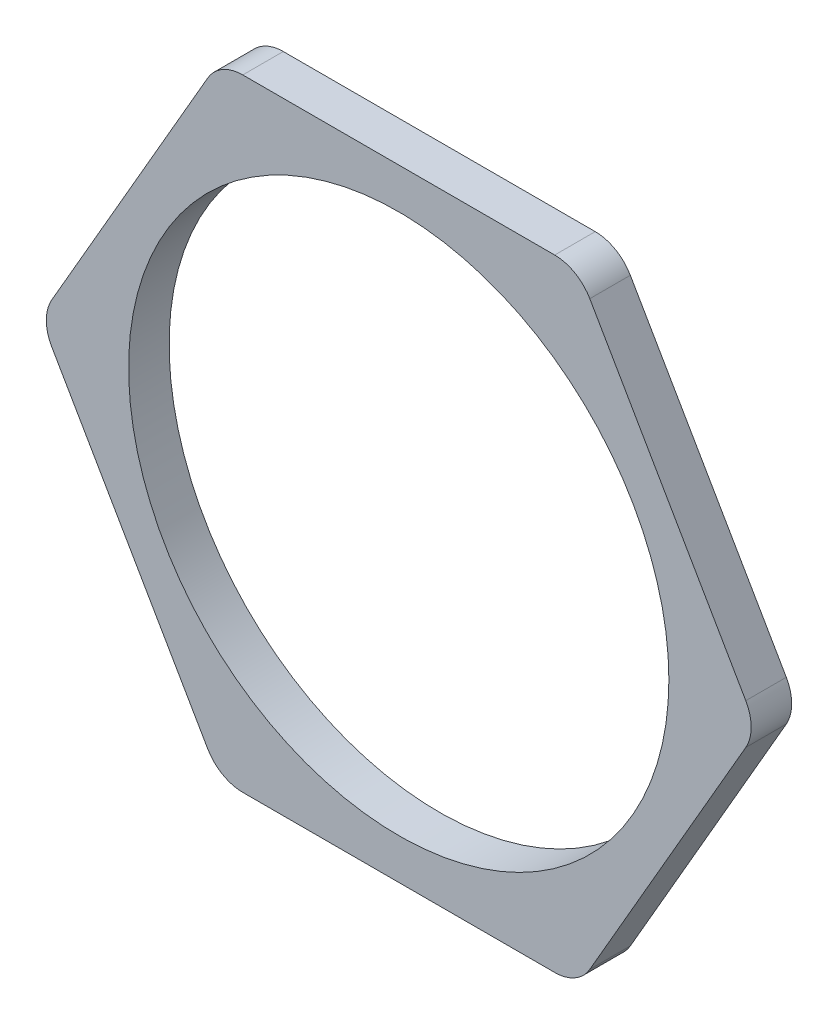
from build123d import *

# Parameters (mm, degrees)
SKETCH1_R           = 20
BOSS_EXTRUDE1_DEPTH = 3
FILLET4_R           = 3


with BuildPart() as part:
    # Sketch1 → Boss-Extrude1 (new body)
    with BuildSketch(Plane.XY):
        Polygon((-13.279056191, 23), (-26.558112383, 0), (-13.279056191, -23), (13.279056191, -23), (26.558112383, 0), (13.279056191, 23), align=None)
        Circle(SKETCH1_R, mode=Mode.SUBTRACT)
    extrude(amount=BOSS_EXTRUDE1_DEPTH)

    # Fillet4
    fillet4_edges = [part.edges().sort_by_distance(p)[0] for p in [
        (-26.558112383, 0, 1.5),
        (-13.279056191, 23, 1.5),
        (13.279056191, 23, 1.5),
        (26.558112383, 0, 1.5),
        (13.279056191, -23, 1.5),
        (-13.279056191, -23, 1.5),
    ]]
    fillet(fillet4_edges, radius=FILLET4_R)


solid = part.part
